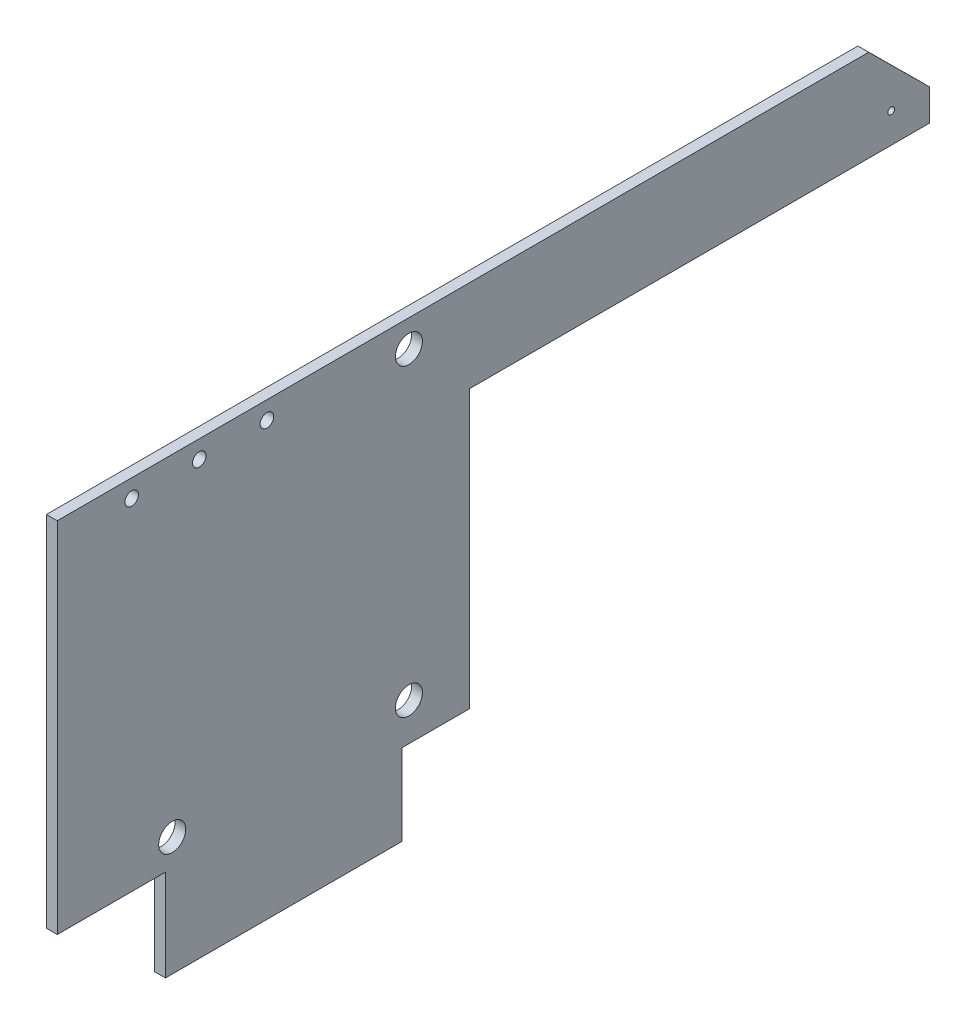
from build123d import *

# Parameters (mm, degrees)
SKETCH1_R           = 2
SKETCH1_R_2         = 1
SKETCH1_R_3         = 0.5
BOSS_EXTRUDE1_DEPTH = 1.6


with BuildPart() as part:
    # Sketch1 → Boss-Extrude1 (new body)
    with BuildSketch(Plane(origin=(0, 0, 0), x_dir=(0, 0, -1), z_dir=(1, 0, 0))):
        Polygon((3, 11), (3, 64), (123, 64), (132, 55.063430305), (132, 50.423430305), (64, 50.423430305), (64, 9.436073979), (54, 9.436073979), (54, -2.563926021), (19, -2.563926021), (19, 11), align=None)
        with Locations((20, 15)):
            Circle(SKETCH1_R, mode=Mode.SUBTRACT)
        with Locations((55, 15)):
            Circle(SKETCH1_R, mode=Mode.SUBTRACT)
        with Locations((55, 60)):
            Circle(SKETCH1_R, mode=Mode.SUBTRACT)
        with Locations((14, 61.35)):
            Circle(SKETCH1_R_2, mode=Mode.SUBTRACT)
        with Locations((24, 61.35)):
            Circle(SKETCH1_R_2, mode=Mode.SUBTRACT)
        with Locations((34, 61.35)):
            Circle(SKETCH1_R_2, mode=Mode.SUBTRACT)
        with Locations((126.328248558, 54.83220241)):
            Circle(SKETCH1_R_3, mode=Mode.SUBTRACT)
    extrude(amount=BOSS_EXTRUDE1_DEPTH)


solid = part.part
